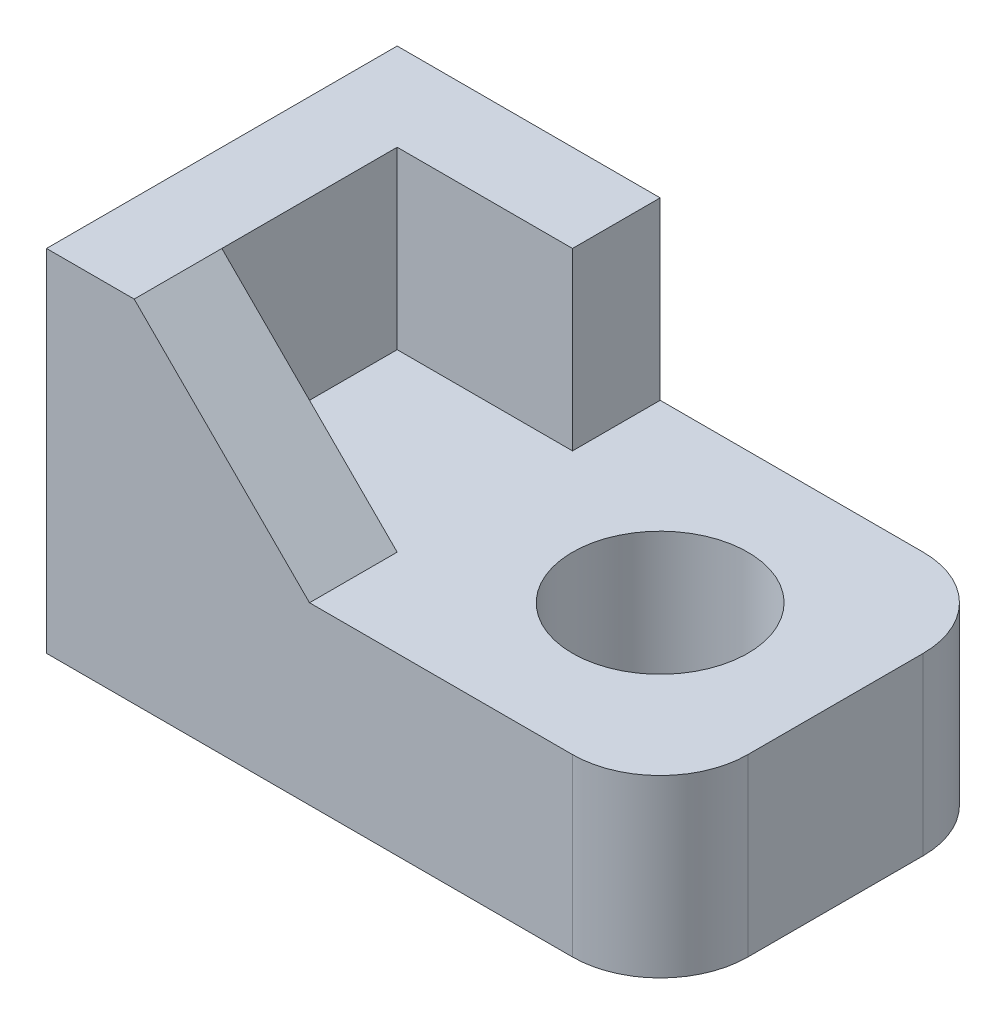
from build123d import *

# Parameters (mm, degrees)
SKETCH_1_R      = 10
EXTRUDE_1_DEPTH = 20
EXTRUDE_2_DEPTH = 20
EXTRUDE_3_DEPTH = 10


with BuildPart() as part:
    # 草圖1 → 填料-伸長1 (new body)
    with BuildSketch(Plane(origin=(0, 0, 0), x_dir=(1, 0, 0), z_dir=(0, 1, 0))):
        with BuildLine():
            Line((0, 0), (60, 0))
            ThreePointArc((60, 0), (67.071067812, 2.928932188), (70, 10))
            Line((70, 10), (70, 30))
            ThreePointArc((70, 30), (67.071067812, 37.071067812), (60, 40))
            Line((60, 40), (0, 40))
            Line((0, 40), (0, 0))
        make_face()
        with Locations(Location((50, 20, 0), (0, 0, 270))):
            Circle(SKETCH_1_R, mode=Mode.SUBTRACT)
    extrude(amount=EXTRUDE_1_DEPTH)

    # 草圖2 → 填料-伸長2 (add)
    with BuildSketch(Plane(origin=(0, 20, 0), x_dir=(1, 0, 0), z_dir=(0, 1, 0))):
        Polygon((0, 0), (0, 40), (30, 40), (30, 30), (10, 30), (10, 0), align=None)
    extrude(amount=EXTRUDE_2_DEPTH)

    # 草圖3 → 填料-伸長3 (add)
    with BuildSketch(Plane.XY):
        Polygon((10, 40), (30, 20), (10, 20), align=None)
    extrude(amount=-EXTRUDE_3_DEPTH)


solid = part.part
